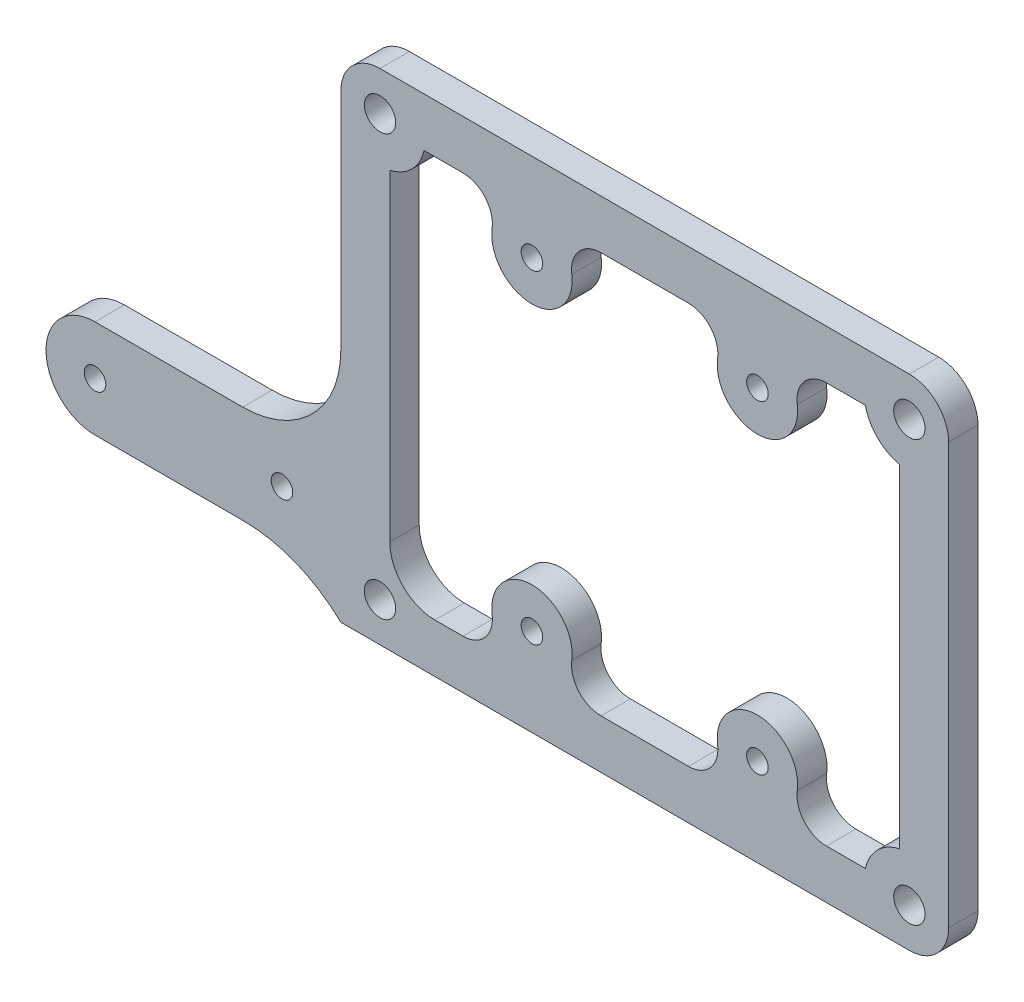
from build123d import *

# Parameters (mm, degrees)
SKETCH_1_R      = 1.6
SKETCH_1_R_2    = 1.1
EXTRUDE_1_DEPTH = 3
FILLET_2_R      = 4


with BuildPart() as part:
    # 草图1 → 凸台-拉伸1 (new body)
    with BuildSketch(Plane.XY):
        with BuildLine():
            Line((-31, 25.46), (31, 25.46))
            Line((31, 25.46), (31, -25.46))
            Line((31, -25.46), (-31, -25.46))
            ThreePointArc((-31, -25.46), (-35.614835193, -22.497087982), (-41, -21.46))
            Line((-41, -21.46), (-56.07, -21.46))
            ThreePointArc((-56.07, -21.46), (-61.07, -16.46), (-56.07, -11.46))
            Line((-56.07, -11.46), (-41, -11.46))
            ThreePointArc((-41, -11.46), (-33.928932188, -8.531067812), (-31, -1.46))
            Line((-31, -1.46), (-31, 25.46))
        make_face()
        with Locations((-27, 21.46)):
            Circle(SKETCH_1_R, mode=Mode.SUBTRACT)
        with Locations((27, 21.46)):
            Circle(SKETCH_1_R, mode=Mode.SUBTRACT)
        with Locations((-27, -21.46)):
            Circle(SKETCH_1_R, mode=Mode.SUBTRACT)
        with Locations((27, -21.46)):
            Circle(SKETCH_1_R, mode=Mode.SUBTRACT)
        with Locations((-11.5, 16.5)):
            Circle(SKETCH_1_R_2, mode=Mode.SUBTRACT)
        with Locations((11.5, 16.5)):
            Circle(SKETCH_1_R_2, mode=Mode.SUBTRACT)
        with Locations((11.5, -16.5)):
            Circle(SKETCH_1_R_2, mode=Mode.SUBTRACT)
        with Locations((-11.5, -16.5)):
            Circle(SKETCH_1_R_2, mode=Mode.SUBTRACT)
        with Locations((-56.07, -16.46)):
            Circle(SKETCH_1_R_2, mode=Mode.SUBTRACT)
        with Locations((-37, -16.46)):
            Circle(SKETCH_1_R_2, mode=Mode.SUBTRACT)
        with BuildLine():
            Line((-22.510011136, 20.46), (-18.534799215, 20.46))
            ThreePointArc((-18.534799215, 20.46), (-16.274611014, 19.432701015), (-15.562348843, 17.054366197))
            ThreePointArc((-15.562348843, 17.054366197), (-11.5, 12.4), (-7.437651157, 17.054366197))
            ThreePointArc((-7.437651157, 17.054366197), (-6.725388986, 19.432701015), (-4.465200785, 20.46))
            Line((-4.465200785, 20.46), (4.465200785, 20.46))
            ThreePointArc((4.465200785, 20.46), (6.725388986, 19.432701015), (7.437651157, 17.054366197))
            ThreePointArc((7.437651157, 17.054366197), (11.5, 12.4), (15.562348843, 17.054366197))
            ThreePointArc((15.562348843, 17.054366197), (16.274611014, 19.432701015), (18.534799215, 20.46))
            Line((18.534799215, 20.46), (22.510011136, 20.46))
            ThreePointArc((22.510011136, 20.46), (23.747308807, 18.207308807), (26, 16.970011136))
            Line((26, 16.970011136), (26, -16.970011136))
            ThreePointArc((26, -16.970011136), (23.747308807, -18.207308807), (22.510011136, -20.46))
            Line((22.510011136, -20.46), (18.534799215, -20.46))
            ThreePointArc((18.534799215, -20.46), (16.274611014, -19.432701015), (15.562348843, -17.054366197))
            ThreePointArc((15.562348843, -17.054366197), (11.5, -12.4), (7.437651157, -17.054366197))
            ThreePointArc((7.437651157, -17.054366197), (6.725388986, -19.432701015), (4.465200785, -20.46))
            Line((4.465200785, -20.46), (-4.465200785, -20.46))
            ThreePointArc((-4.465200785, -20.46), (-6.725388986, -19.432701015), (-7.437651157, -17.054366197))
            ThreePointArc((-7.437651157, -17.054366197), (-11.5, -12.4), (-15.562348843, -17.054366197))
            ThreePointArc((-15.562348843, -17.054366197), (-16.274611014, -19.432701015), (-18.534799215, -20.46))
            Line((-18.534799215, -20.46), (-21.4, -20.46))
            ThreePointArc((-21.4, -20.46), (-24.652691193, -19.112691193), (-26, -15.86))
            Line((-26, -15.86), (-26, 16.970011136))
            ThreePointArc((-26, 16.970011136), (-23.747308807, 18.207308807), (-22.510011136, 20.46))
        make_face(mode=Mode.SUBTRACT)
    extrude(amount=EXTRUDE_1_DEPTH)

    # 圆角2
    fillet_2_edges = [part.edges().sort_by_distance(p)[0] for p in [
        (-31, 25.46, 1.5),
        (31, 25.46, 1.5),
        (31, -25.46, 1.5),
    ]]
    fillet(fillet_2_edges, radius=FILLET_2_R)


solid = part.part
